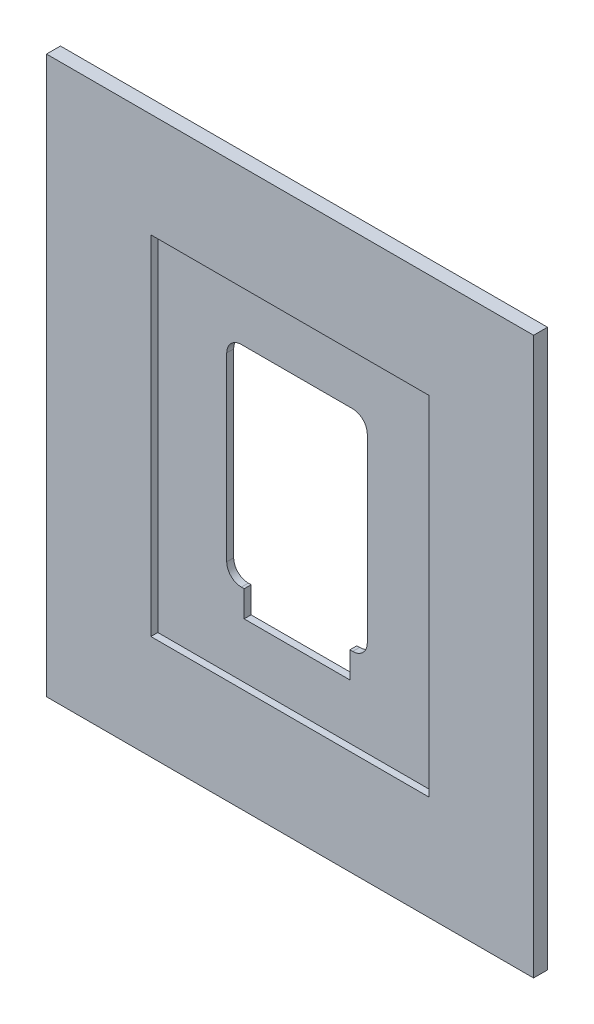
from build123d import *

# Parameters (mm, degrees)
SKETCH_1_W          = 140
SKETCH_1_H          = 160
EXTRUDE_1_DEPTH     = 2
SKETCH_2_W          = 140
SKETCH_2_H          = 160
SKETCH_2_W_2        = 80
SKETCH_2_H_2        = 100
EXTRUDE_2_DEPTH     = 2
CUT_EXTRUDE_1_DEPTH = 2


with BuildPart() as part:
    # 草图1 → 凸台-拉伸1 (new body)
    with BuildSketch(Plane.XY):
        Rectangle(SKETCH_1_W, SKETCH_1_H)
    extrude(amount=EXTRUDE_1_DEPTH)

    # 草图2 → 凸台-拉伸2 (add)
    with BuildSketch(Plane.XY.offset(2)):
        Rectangle(SKETCH_2_W, SKETCH_2_H)
        Rectangle(SKETCH_2_W_2, SKETCH_2_H_2, mode=Mode.SUBTRACT)
    extrude(amount=EXTRUDE_2_DEPTH)

    # 草图4 → 切除-拉伸1 (cut)
    with BuildSketch(Plane.XY.offset(2)):
        with BuildLine():
            Line((-10.8, -34.2), (-6.8, -34.2))
            Line((-6.8, -34.2), (6.8, -34.2))
            Line((6.8, -34.2), (10.8, -34.2))
            Line((10.8, -34.2), (11.2, -34.2))
            Line((11.2, -34.2), (15.2, -34.2))
            Line((15.2, -34.2), (15.2, -26.7))
            Line((15.2, -26.7), (16, -26.7))
            ThreePointArc((16, -26.7), (18.969848481, -25.469848481), (20.2, -22.5))
            Line((20.2, -22.5), (20.2, 29.5))
            ThreePointArc((20.2, 29.5), (18.969848481, 32.469848481), (16, 33.7))
            Line((16, 33.7), (-16, 33.7))
            ThreePointArc((-16, 33.7), (-18.969848481, 32.469848481), (-20.2, 29.5))
            Line((-20.2, 29.5), (-20.2, -22.5))
            ThreePointArc((-20.2, -22.5), (-18.969848481, -25.469848481), (-16, -26.7))
            Line((-16, -26.7), (-15.2, -26.7))
            Line((-15.2, -26.7), (-15.2, -34.2))
            Line((-15.2, -34.2), (-11.2, -34.2))
            Line((-11.2, -34.2), (-10.8, -34.2))
        make_face()
    extrude(amount=-CUT_EXTRUDE_1_DEPTH, mode=Mode.SUBTRACT)


solid = part.part
